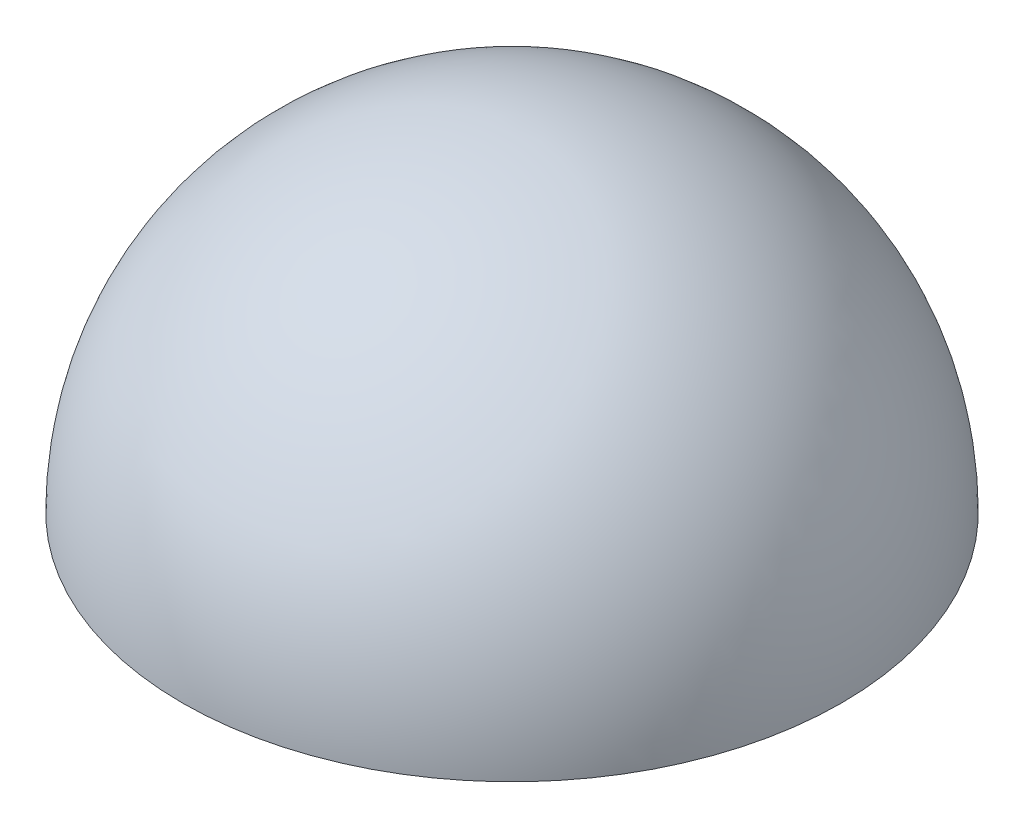
from build123d import *

# Parameters (mm, degrees)
CROQUIS_AGUJEROS_MONTAJE_R = 4
AGUJERO_INSERTO_M6_DEPTH   = 14


with BuildPart() as part:
    # Croquis_perfil → Domo_D120 (revolve)
    with BuildSketch(Plane.XY):
        with BuildLine():
            Line((0, 0), (60, 0))
            ThreePointArc((60, 0), (42.426406871, 42.426406871), (0, 60))
            Line((0, 60), (0, 0))
        make_face()
    revolve(axis=Axis((0, 0, 0), (0, 1, 0)))

    # Croquis_agujeros_montaje → Agujero_inserto_M6 (cut)
    with BuildSketch(Plane(origin=(0, 0, 0), x_dir=(1, 0, 0), z_dir=(0, 1, 0))):
        with Locations(Location((0, 0, 0), (0, 0, 270))):
            Circle(CROQUIS_AGUJEROS_MONTAJE_R)
    extrude(amount=AGUJERO_INSERTO_M6_DEPTH, mode=Mode.SUBTRACT)


solid = part.part
